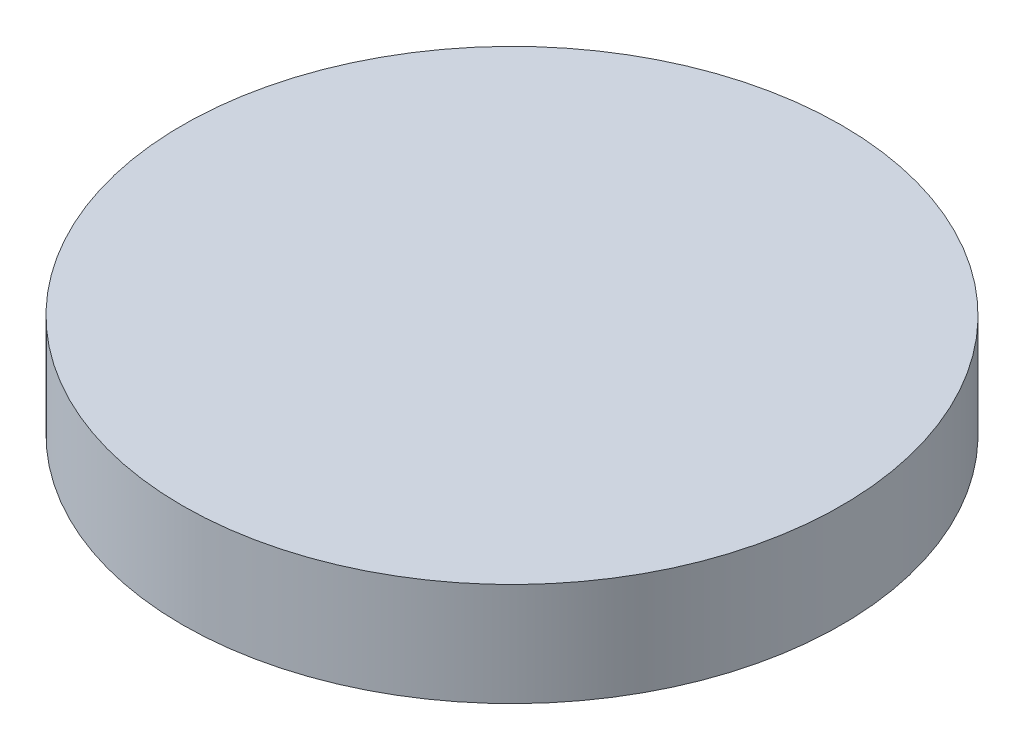
from build123d import *

# Parameters (mm, degrees)
SKETCH1_R           = 5.75
BOSS_EXTRUDE1_DEPTH = 1.8


with BuildPart() as part:
    # Sketch1 → Boss-Extrude1 (new body)
    with BuildSketch(Plane(origin=(0, 0, 0), x_dir=(1, 0, 0), z_dir=(0, 1, 0))):
        with Locations(Location((0, 0, 0), (0, 0, 270))):
            Circle(SKETCH1_R)
    extrude(amount=BOSS_EXTRUDE1_DEPTH)


solid = part.part
